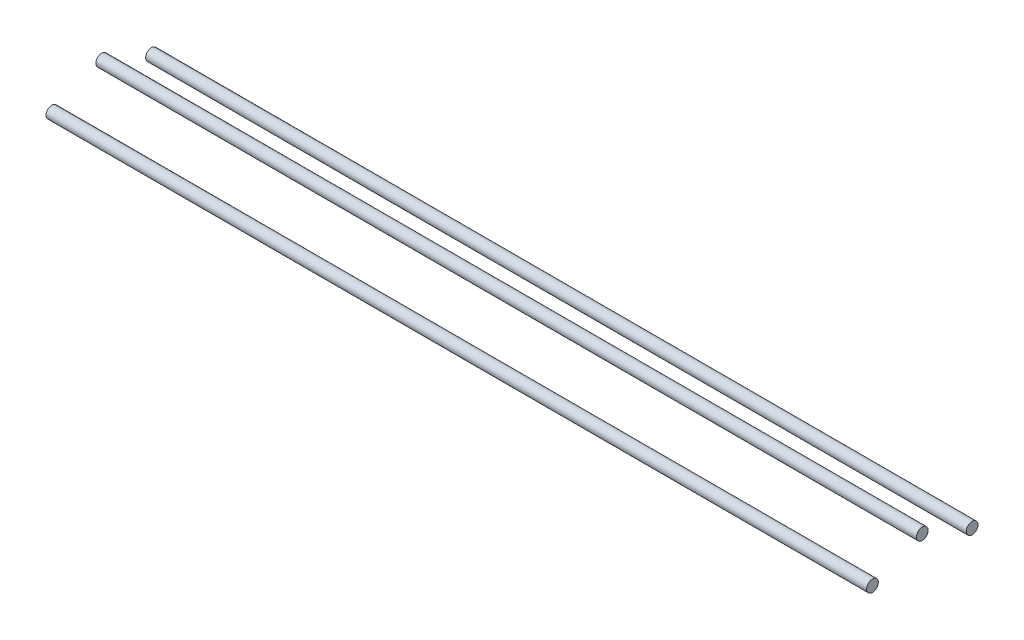
from build123d import *

# Parameters (mm, degrees)
BOSS_EXTRUDE1_START   = 10
SKETCH2_R             = 3
BOSS_EXTRUDE1_DEPTH   = 420
BOSS_EXTRUDE1_2_DEPTH = 420
BOSS_EXTRUDE1_3_DEPTH = 420


with BuildPart() as part:
    # Sketch2 → Boss-Extrude1 (new body)
    with BuildSketch(Plane(origin=(0, 0, 0), x_dir=(0, 0, -1), z_dir=(1, 0, 0)).offset(BOSS_EXTRUDE1_START)):
        with Locations((25.5, 0)):
            Circle(SKETCH2_R)
    extrude(amount=-BOSS_EXTRUDE1_DEPTH)


with BuildPart() as body_2:
    # Sketch2 → Boss-Extrude1 2 (new body)
    with BuildSketch(Plane(origin=(0, 0, 0), x_dir=(0, 0, -1), z_dir=(1, 0, 0)).offset(BOSS_EXTRUDE1_START)):
        with Locations((0, 10.267190122)):
            Circle(SKETCH2_R)
    extrude(amount=-BOSS_EXTRUDE1_2_DEPTH)


with BuildPart() as body_3:
    # Sketch2 → Boss-Extrude1 3 (new body)
    with BuildSketch(Plane(origin=(0, 0, 0), x_dir=(0, 0, -1), z_dir=(1, 0, 0)).offset(BOSS_EXTRUDE1_START)):
        with Locations((-25.5, 0)):
            Circle(SKETCH2_R)
    extrude(amount=-BOSS_EXTRUDE1_3_DEPTH)


solid = Compound([part.part, body_2.part, body_3.part])
